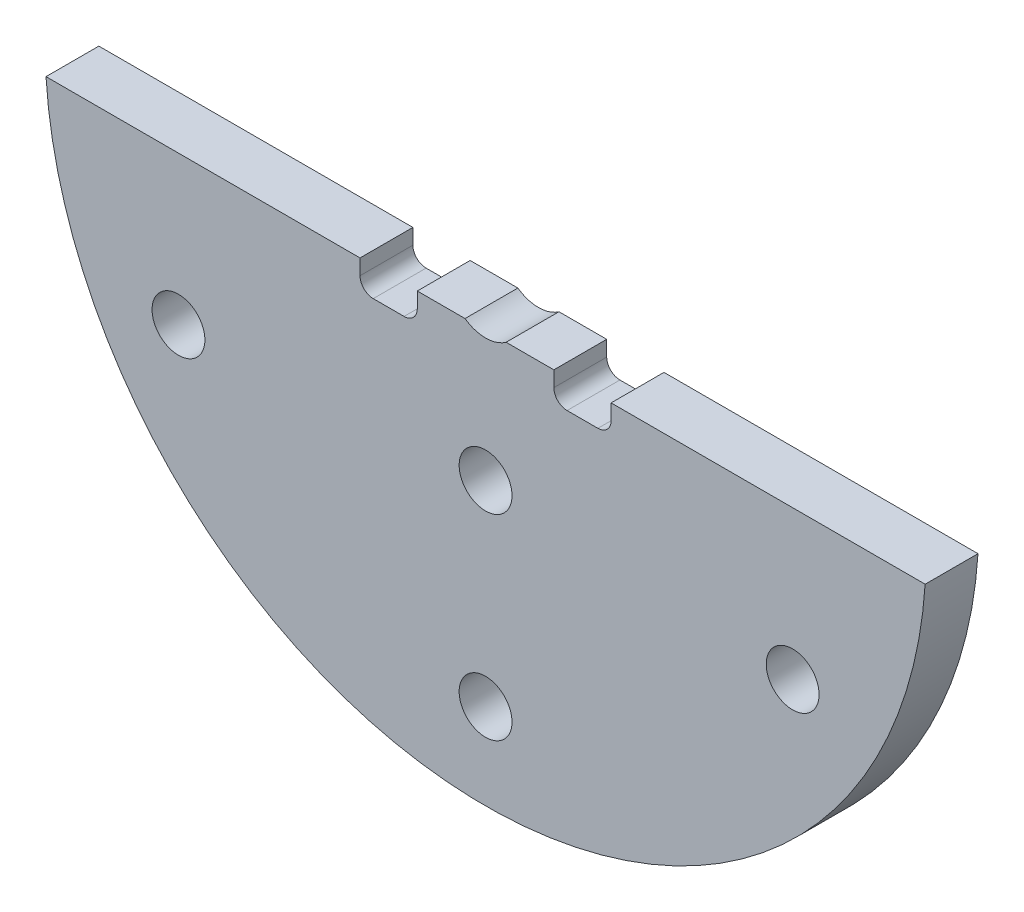
from build123d import *

# Parameters (mm, degrees)
MODEL_R                 = 1.5
SALIENTE_EXTRUIR1_DEPTH = 3


with BuildPart() as part:
    # Model → Saliente-Extruir1 (new body)
    with BuildSketch(Plane.XY):
        with BuildLine():
            Line((191.396871733, 188.964281637), (194.105949351, 188.964281637))
            Line((194.105949351, 188.964281637), (194.105949351, 188.089281637))
            ThreePointArc((194.105949351, 188.089281637), (194.325619265, 187.558951551), (194.855949351, 187.339281637))
            Line((194.855949351, 187.339281637), (196.605949351, 187.339281637))
            ThreePointArc((196.605949351, 187.339281637), (197.136279437, 187.558951551), (197.355949351, 188.089281637))
            Line((197.355949351, 188.089281637), (197.355949351, 188.964281637))
            Line((197.355949351, 188.964281637), (215.17808095, 188.964281637))
            ThreePointArc((215.17808095, 188.964281637), (208.476468276, 173.498317967), (193.480949351, 165.80143179))
            ThreePointArc((193.480949351, 165.80143179), (174.362087289, 171.27143453), (165.283817753, 188.964281637))
            Line((165.283817753, 188.964281637), (183.105949351, 188.964281637))
            Line((183.105949351, 188.964281637), (183.105949351, 188.089281637))
            ThreePointArc((183.105949351, 188.089281637), (183.325619265, 187.558951551), (183.855949351, 187.339281637))
            Line((183.855949351, 187.339281637), (185.605949351, 187.339281637))
            ThreePointArc((185.605949351, 187.339281637), (186.136279437, 187.558951551), (186.355949351, 188.089281637))
            Line((186.355949351, 188.089281637), (186.355949351, 188.964281637))
            Line((186.355949351, 188.964281637), (189.06502697, 188.964281637))
            ThreePointArc((189.06502697, 188.964281637), (190.230949351, 188.589281637), (191.396871733, 188.964281637))
        make_face()
        with Locations((172.802524293, 180.526975738)):
            Circle(MODEL_R, mode=Mode.SUBTRACT)
        with Locations((190.230949351, 170.464669839)):
            Circle(MODEL_R, mode=Mode.SUBTRACT)
        with Locations((207.659374409, 180.526975738)):
            Circle(MODEL_R, mode=Mode.SUBTRACT)
        with Locations((190.230949351, 181.589281637)):
            Circle(MODEL_R, mode=Mode.SUBTRACT)
    extrude(amount=SALIENTE_EXTRUIR1_DEPTH)


solid = part.part
